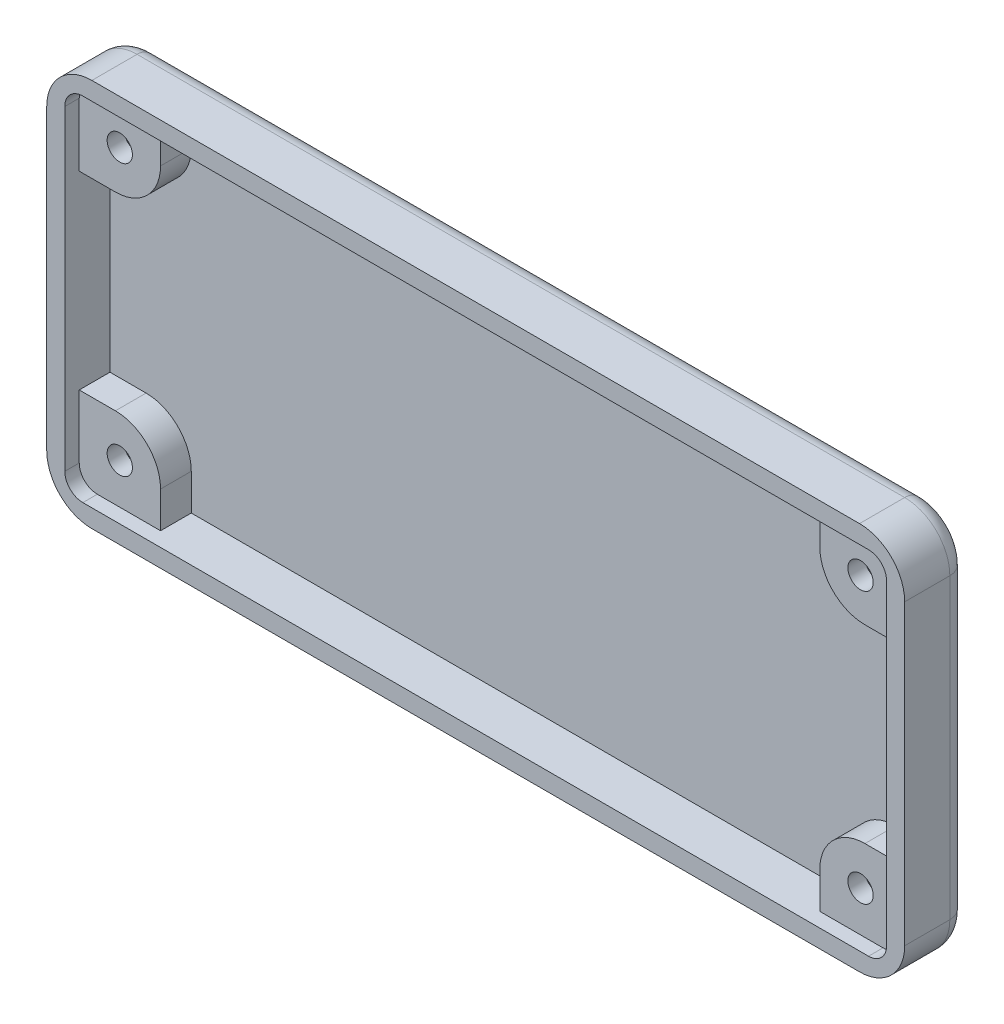
from build123d import *

# Parameters (mm, degrees)
SKETCH_1_W          = 94.97478029
SKETCH_1_H          = 42.97467615
SKETCH_1_W_2        = 90.97478029
SKETCH_1_H_2        = 38.97467615
EXTRUDE_1_DEPTH     = 5
SKETCH_2_W          = 9
SKETCH_2_H          = 9
EXTRUDE_2_DEPTH     = 3.4
FILLET_1_R          = 5
SKETCH_3_W          = 94.97478029
SKETCH_3_H          = 42.97467615
EXTRUDE_3_DEPTH     = 2
SKETCH_4_R          = 2.4
CUT_EXTRUDE_1_DEPTH = 3.5
SKETCH_5_R          = 1.4
CUT_EXTRUDE_2_DEPTH = 102.021837464
FILLET_2_R          = 5
FILLET_3_R          = 2
FILLET_4_R          = 2


with BuildPart() as part:
    # 草图1 → 凸台-拉伸1 (new body)
    with BuildSketch(Plane(origin=(0, 0, 1.6000508), x_dir=(-1, 0, 0), z_dir=(0, 0, -1))):
        with Locations((-45.00009017, -19.0000381)):
            Rectangle(SKETCH_1_W, SKETCH_1_H)
        with Locations((-45.00009017, -19.0000381)):
            Rectangle(SKETCH_1_W_2, SKETCH_1_H_2, mode=Mode.SUBTRACT)
    extrude(amount=EXTRUDE_1_DEPTH)

    # 草图2 → 凸台-拉伸2 (add)
    with BuildSketch(Plane(origin=(0, 0, -3.3999492), x_dir=(-1, 0, 0), z_dir=(0, 0, -1))):
        with Locations((-85.987480315, -4.012700025)):
            Rectangle(SKETCH_2_W, SKETCH_2_H)
        with Locations((-4.012700025, -4.012700025)):
            Rectangle(SKETCH_2_W, SKETCH_2_H)
        with Locations((-4.012700025, -33.987376175)):
            Rectangle(SKETCH_2_W, SKETCH_2_H)
        with Locations((-85.987480315, -33.987376175)):
            Rectangle(SKETCH_2_W, SKETCH_2_H)
    extrude(amount=-EXTRUDE_2_DEPTH)

    # 圆角1
    fillet_1_edges = [part.edges().sort_by_distance(p)[0] for p in [
        (81.487480315, -29.487376175, -1.6999492),
        (8.512700025, -29.487376175, -1.6999492),
        (8.512700025, -8.512700025, -1.6999492),
        (81.487480315, -8.512700025, -1.6999492),
    ]]
    fillet(fillet_1_edges, radius=FILLET_1_R)

    # 草图3 → 凸台-拉伸3 (add)
    with BuildSketch(Plane(origin=(0, 0, -3.3999492), x_dir=(-1, 0, 0), z_dir=(0, 0, -1))):
        with Locations((-45.00009017, -19.0000381)):
            Rectangle(SKETCH_3_W, SKETCH_3_H)
    extrude(amount=EXTRUDE_3_DEPTH)

    # 草图4 → 切除-拉伸1 (cut)
    with BuildSketch(Plane(origin=(0, 0, -5.3999492), x_dir=(-1, 0, 0), z_dir=(0, 0, -1))):
        with Locations((-86.00017272, -4.00000762)):
            Circle(SKETCH_4_R)
        with Locations((-4.00000762, -4.00000762)):
            Circle(SKETCH_4_R)
        with Locations((-4.00000762, -34.00006858)):
            Circle(SKETCH_4_R)
        with Locations((-86.00017272, -34.00006858)):
            Circle(SKETCH_4_R)
    extrude(amount=-CUT_EXTRUDE_1_DEPTH, mode=Mode.SUBTRACT)

    # 草图5 → 切除-拉伸2 (cut, through all)
    with BuildSketch(Plane(origin=(0, 0, -1.8999492), x_dir=(-1, 0, 0), z_dir=(0, 0, -1))):
        with Locations((-86.00017272, -4.00000762)):
            Circle(SKETCH_5_R)
        with Locations((-4.00000762, -4.00000762)):
            Circle(SKETCH_5_R)
        with Locations((-4.00000762, -34.00006858)):
            Circle(SKETCH_5_R)
        with Locations((-86.00017272, -34.00006858)):
            Circle(SKETCH_5_R)
    extrude(amount=-CUT_EXTRUDE_2_DEPTH, mode=Mode.SUBTRACT)

    # 圆角2
    fillet_2_edges = [part.edges().sort_by_distance(p)[0] for p in [
        (92.487480315, 2.487299975, -1.8999492),
        (-2.487299975, 2.487299975, -1.8999492),
        (-2.487299975, -40.487376175, -1.8999492),
        (92.487480315, -40.487376175, -1.8999492),
    ]]
    fillet(fillet_2_edges, radius=FILLET_2_R)

    # 圆角3
    fillet_3_edges = [part.edges().sort_by_distance(p)[0] for p in [
        (45.00009017, -40.487376175, -5.3999492),
        (92.487480315, -19.0000381, -5.3999492),
        (-2.487299975, -19.0000381, -5.3999492),
        (45.00009017, 2.487299975, -5.3999492),
        (91.023014221, 1.022833881, -5.3999492),
        (-1.022833881, 1.022833881, -5.3999492),
        (-1.022833881, -39.022910081, -5.3999492),
        (91.023014221, -39.022910081, -5.3999492),
    ]]
    fillet(fillet_3_edges, radius=FILLET_3_R)

    # 圆角4
    fillet_4_edges = [part.edges().sort_by_distance(p)[0] for p in [
        (-0.487299975, 0.487299975, 0.8000508),
        (90.487480315, 0.487299975, 0.8000508),
        (-0.487299975, -38.487376175, 0.8000508),
        (90.487480315, -38.487376175, 0.8000508),
    ]]
    fillet(fillet_4_edges, radius=FILLET_4_R)


solid = part.part
